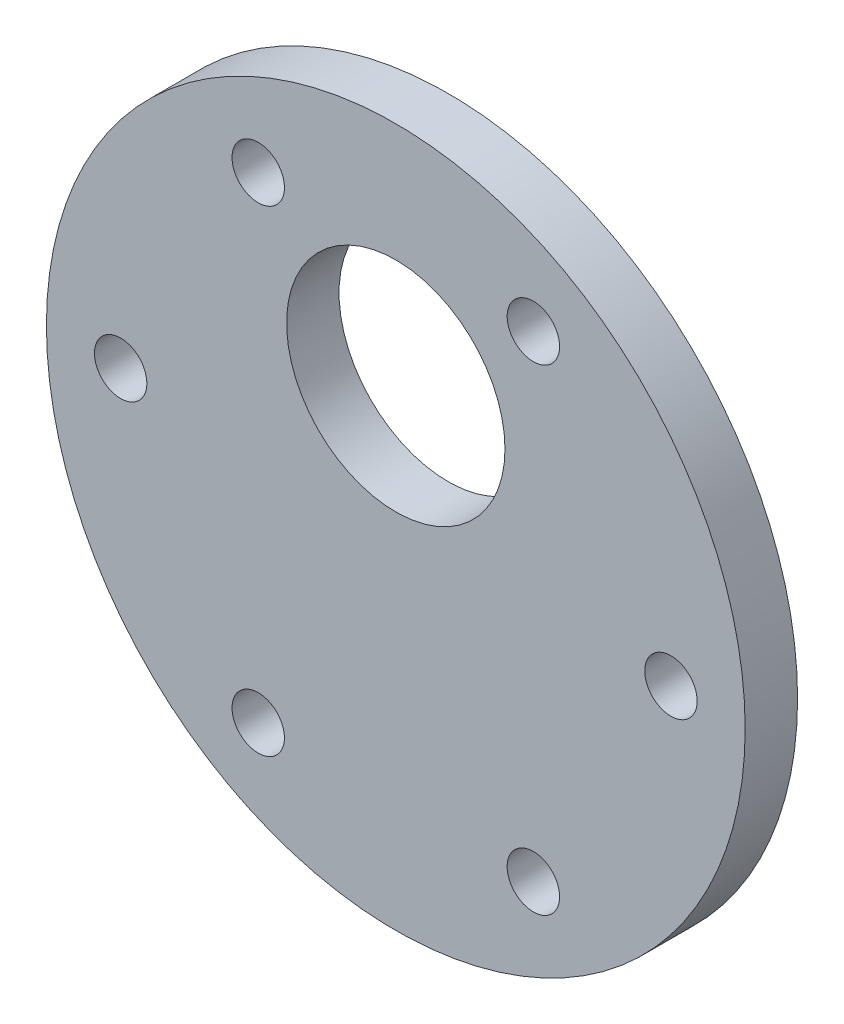
from build123d import *

# Parameters (mm, degrees)
SKETCH3_R               = 20
BOSS_EXTRUDE1_DEPTH     = 3
CUT_EXTRUDE2_DEPTH      = 29.442925307
CUT_EXTRUDE2_DEPTH_BACK = 29.442925307
SKETCH2_R               = 1.5
SKETCH2_R_2             = 6.25


with BuildPart() as part:
    # Sketch3 → Boss-Extrude1 (new body)
    with BuildSketch(Plane.XY):
        Circle(SKETCH3_R)
    extrude(amount=BOSS_EXTRUDE1_DEPTH)

    # Sketch2 → Cut-Extrude2 (cut, two sides: drawn at the far end of the back side and taken through both)
    with BuildSketch(Plane.XY.offset(-CUT_EXTRUDE2_DEPTH_BACK)):
        with Locations((-15.75, 0)):
            Circle(SKETCH2_R)
        with Locations((-7.875, 13.63990011)):
            Circle(SKETCH2_R)
        with Locations((7.875, 13.63990011)):
            Circle(SKETCH2_R)
        with Locations((15.75, 0)):
            Circle(SKETCH2_R)
        with Locations((7.875, -13.63990011)):
            Circle(SKETCH2_R)
        with Locations((-7.875, -13.63990011)):
            Circle(SKETCH2_R)
        with Locations((0, 7)):
            Circle(SKETCH2_R_2)
    extrude(amount=CUT_EXTRUDE2_DEPTH + CUT_EXTRUDE2_DEPTH_BACK, mode=Mode.SUBTRACT)


solid = part.part
